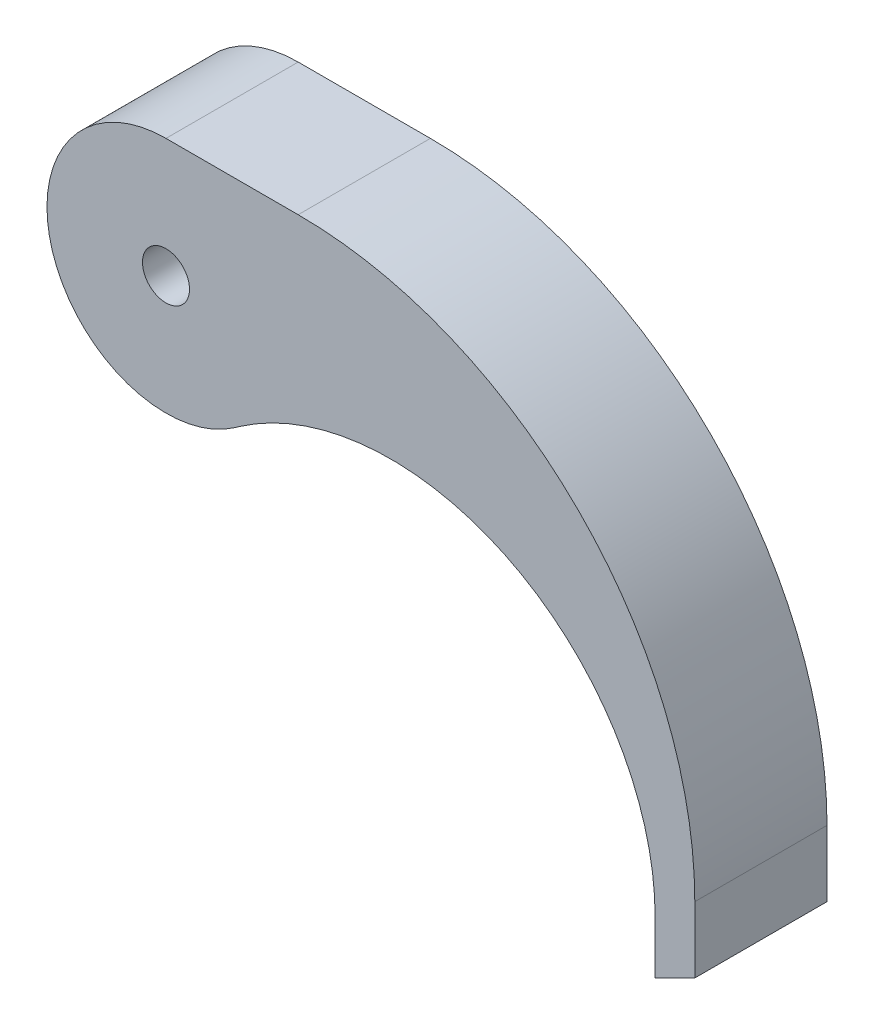
from build123d import *

# Parameters (mm, degrees)
SKETCH1_R           = 1.778
BOSS_EXTRUDE1_DEPTH = 10


with BuildPart() as part:
    # Sketch1 → Boss-Extrude1 (new body)
    with BuildSketch(Plane.XY):
        with BuildLine():
            Line((0, 9), (10, 9))
            ThreePointArc((10, 9), (31.213203436, 0.213203436), (40, -21))
            Line((40, -21), (40, -26))
            Line((40, -26), (37, -27.5))
            Line((37, -27.5), (37, -23.5))
            ThreePointArc((37, -23.5), (26.251320134, -5.768303077), (5.558692422, -7.095839525))
            Line((5.558692422, -7.095839525), (5.14858841, -7.381872214))
            ThreePointArc((5.14858841, -7.381872214), (-8.585943452, -2.698439371), (0, 9))
        make_face()
        Circle(SKETCH1_R, mode=Mode.SUBTRACT)
    extrude(amount=BOSS_EXTRUDE1_DEPTH)


solid = part.part
